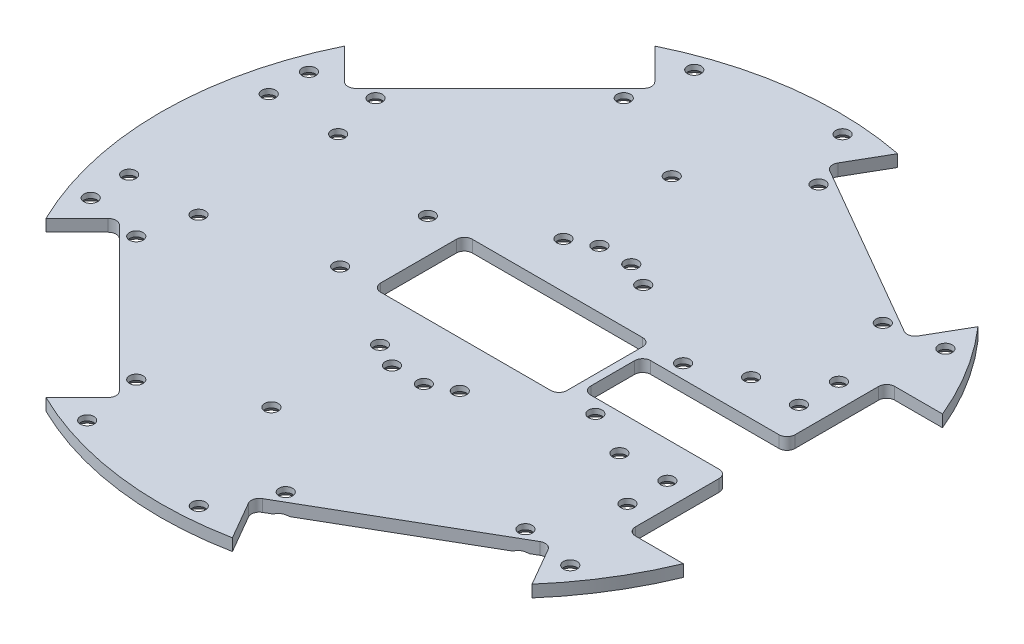
from build123d import *

# Parameters (mm, degrees)
ESBO_O1_R                            = 1.7
ESBO_O1_R_2                          = 1.5
BASE_DEPTH                           = 3
ESBO_O21_R                           = 1.5
BOCA_CHUTE_DEPTH                     = 20
ESBO_O32_W                           = 15
ESBO_O32_H                           = 3
CORTE_EXTRUS_O2_DEPTH                = 36.19
ESBO_O33_W                           = 46.7
ESBO_O33_H                           = 23
CORTE_EXTRUS_O3_DEPTH                = 121.245582039
ESCAREADO_PARA_SFHCS_M31_AT_2_COUNT  = 2
ESCAREADO_PARA_SFHCS_M31_AT_2_PITCH  = 21.433109141
ESCAREADO_PARA_SFHCS_M31_AT_3_COUNT  = 2
ESCAREADO_PARA_SFHCS_M31_AT_3_PITCH  = 31.142167091
ESCAREADO_PARA_SFHCS_M31_AT_4_COUNT  = 2
ESCAREADO_PARA_SFHCS_M31_AT_4_PITCH  = 13.637440316
ESCAREADO_PARA_SFHCS_M31_AT_5_COUNT  = 2
ESCAREADO_PARA_SFHCS_M31_AT_5_PITCH  = 35.526804411
ESCAREADO_PARA_SFHCS_M31_AT_6_COUNT  = 2
ESCAREADO_PARA_SFHCS_M31_AT_6_PITCH  = 46.701207559
ESCAREADO_PARA_SFHCS_M31_AT_7_COUNT  = 2
ESCAREADO_PARA_SFHCS_M31_AT_7_PITCH  = 55.221424698
ESCAREADO_PARA_SFHCS_M31_AT_8_COUNT  = 2
ESCAREADO_PARA_SFHCS_M31_AT_8_PITCH  = 68.331301379
ESCAREADO_PARA_SFHCS_M31_AT_9_COUNT  = 2
ESCAREADO_PARA_SFHCS_M31_AT_9_PITCH  = 71.833928112
ESCAREADO_PARA_SFHCS_M31_AT_10_COUNT = 2
ESCAREADO_PARA_SFHCS_M31_AT_10_PITCH = 69.001855552
ESCAREADO_PARA_SFHCS_M31_AT_11_COUNT = 2
ESCAREADO_PARA_SFHCS_M31_AT_11_PITCH = 61.430565004
ESCAREADO_PARA_SFHCS_M31_AT_12_COUNT = 2
ESCAREADO_PARA_SFHCS_M31_AT_12_PITCH = 57.028018756
ESCAREADO_PARA_SFHCS_M31_AT_13_COUNT = 2
ESCAREADO_PARA_SFHCS_M31_AT_13_PITCH = 75.637618321
ESCAREADO_PARA_SFHCS_M31_AT_14_COUNT = 2
ESCAREADO_PARA_SFHCS_M31_AT_14_PITCH = 96.525270503
ESCAREADO_PARA_SFHCS_M31_AT_15_COUNT = 2
ESCAREADO_PARA_SFHCS_M31_AT_15_PITCH = 95.765279894
ESCAREADO_PARA_SFHCS_M31_AT_16_COUNT = 2
ESCAREADO_PARA_SFHCS_M31_AT_16_PITCH = 100.405860436
ESCAREADO_PARA_SFHCS_M31_AT_17_COUNT = 2
ESCAREADO_PARA_SFHCS_M31_AT_17_PITCH = 126.981552798
ESCAREADO_PARA_SFHCS_M31_AT_18_COUNT = 2
ESCAREADO_PARA_SFHCS_M31_AT_18_PITCH = 126.222537613
ESCAREADO_PARA_SFHCS_M31_AT_19_COUNT = 2
ESCAREADO_PARA_SFHCS_M31_AT_19_PITCH = 143.196261927
ESCAREADO_PARA_SFHCS_M31_AT_20_COUNT = 2
ESCAREADO_PARA_SFHCS_M31_AT_20_PITCH = 141.271614857
ESCAREADO_PARA_SFHCS_M31_AT_21_COUNT = 2
ESCAREADO_PARA_SFHCS_M31_AT_21_PITCH = 65.192076785
ESCAREADO_PARA_SFHCS_M31_AT_22_COUNT = 2
ESCAREADO_PARA_SFHCS_M31_AT_22_PITCH = 66.073141016
ESCAREADO_PARA_SFHCS_M31_AT_23_COUNT = 2
ESCAREADO_PARA_SFHCS_M31_AT_23_PITCH = 63.822728735
ESCAREADO_PARA_SFHCS_M31_AT_24_COUNT = 2
ESCAREADO_PARA_SFHCS_M31_AT_24_PITCH = 73.782092047
ESCAREADO_PARA_SFHCS_M31_AT_25_COUNT = 2
ESCAREADO_PARA_SFHCS_M31_AT_25_PITCH = 94.045640367
ESCAREADO_PARA_SFHCS_M31_AT_26_COUNT = 2
ESCAREADO_PARA_SFHCS_M31_AT_26_PITCH = 92.800098367
ESCAREADO_PARA_SFHCS_M31_AT_27_COUNT = 2
ESCAREADO_PARA_SFHCS_M31_AT_27_PITCH = 124.953160826
ESCAREADO_PARA_SFHCS_M31_AT_28_COUNT = 2
ESCAREADO_PARA_SFHCS_M31_AT_28_PITCH = 140.887171602
ESCAREADO_PARA_SFHCS_M31_AT_29_COUNT = 2
ESCAREADO_PARA_SFHCS_M31_AT_29_PITCH = 120.82932396
ESCAREADO_PARA_SFHCS_M31_AT_30_COUNT = 2
ESCAREADO_PARA_SFHCS_M31_AT_30_PITCH = 87.05339959
ESCAREADO_PARA_SFHCS_M31_AT_31_COUNT = 2
ESCAREADO_PARA_SFHCS_M31_AT_31_PITCH = 93.08108087
ESCAREADO_PARA_SFHCS_M31_AT_32_COUNT = 2
ESCAREADO_PARA_SFHCS_M31_AT_32_PITCH = 98.24270644
ESCAREADO_PARA_SFHCS_M31_AT_33_COUNT = 2
ESCAREADO_PARA_SFHCS_M31_AT_33_PITCH = 100.235466588
ESCAREADO_PARA_SFHCS_M31_AT_34_COUNT = 2
ESCAREADO_PARA_SFHCS_M31_AT_34_PITCH = 143.756871864
ESCAREADO_PARA_SFHCS_M31_AT_35_COUNT = 2
ESCAREADO_PARA_SFHCS_M31_AT_35_PITCH = 153.728274182
ESCAREADO_PARA_SFHCS_M31_AT_36_COUNT = 2
ESCAREADO_PARA_SFHCS_M31_AT_36_PITCH = 110.228584759
ESCAREADO_PARA_SFHCS_M31_AT_37_COUNT = 2
ESCAREADO_PARA_SFHCS_M31_AT_37_PITCH = 138.649653495
ESCAREADO_PARA_SFHCS_M31_AT_38_COUNT = 2
ESCAREADO_PARA_SFHCS_M31_AT_38_PITCH = 154.262007126
ESCAREADO_PARA_SFHCS_M31_AT_39_COUNT = 2
ESCAREADO_PARA_SFHCS_M31_AT_39_PITCH = 158.442890999
ESCAREADO_PARA_SFHCS_M31_AT_40_COUNT = 2
ESCAREADO_PARA_SFHCS_M31_AT_40_PITCH = 147.537577729
FILETE1_R                            = 2


with BuildPart() as part:
    # Esboço1 → Base (new body)
    with BuildSketch(Plane(origin=(0, 0, 0), x_dir=(1, 0, 0), z_dir=(0, 1, 0))):
        with BuildLine():
            Line((-67.124614158, -28.233741192), (-28.233741192, -67.124614158))
            Line((-28.233741192, -67.124614158), (-37.426129348, -76.317002313))
            ThreePointArc((-37.426129348, -76.317002313), (-11.094726339, -84.272813217), (16.398571251, -83.403158579))
            Line((16.398571251, -83.403158579), (9.898571251, -72.14482833))
            Line((9.898571251, -72.14482833), (57.529968459, -44.64482833))
            Line((57.529968459, -44.64482833), (64.029968459, -55.903158579))
            ThreePointArc((64.029968459, -55.903158579), (85, 0), (64.029968459, 55.903158579))
            Line((64.029968459, 55.903158579), (57.529968459, 44.64482833))
            Line((57.529968459, 44.64482833), (9.898571251, 72.14482833))
            Line((9.898571251, 72.14482833), (16.398571251, 83.403158579))
            ThreePointArc((16.398571251, 83.403158579), (-11.094726339, 84.272813217), (-37.426129348, 76.317002313))
            Line((-37.426129348, 76.317002313), (-28.233741192, 67.124614158))
            Line((-28.233741192, 67.124614158), (-67.124614158, 28.233741192))
            Line((-67.124614158, 28.233741192), (-76.317002313, 37.426129348))
            ThreePointArc((-76.317002313, 37.426129348), (-85, 0), (-76.317002313, -37.426129348))
            Line((-76.317002313, -37.426129348), (-67.124614158, -28.233741192))
        make_face()
        with Locations(Location((-61.114206518, -30.001508145, 0), (0, 0, 270))):
            Circle(ESBO_O1_R, mode=Mode.SUBTRACT)
        with Locations(Location((-30.001508145, -61.114206518, 0), (0, 0, 90))):
            Circle(ESBO_O1_R, mode=Mode.SUBTRACT)
        with Locations(Location((13.161710972, -66.796752118, 0), (0, 0, 270))):
            Circle(ESBO_O1_R, mode=Mode.SUBTRACT)
        with Locations(Location((51.266828739, -44.796752118, 0), (0, 0, 90))):
            Circle(ESBO_O1_R, mode=Mode.SUBTRACT)
        with Locations(Location((-61.114206518, 30.001508145, 0), (0, 0, 90))):
            Circle(ESBO_O1_R, mode=Mode.SUBTRACT)
        with Locations(Location((-30.001508145, 61.114206518, 0), (0, 0, 270))):
            Circle(ESBO_O1_R, mode=Mode.SUBTRACT)
        with Locations(Location((13.161710972, 66.796752118, 0), (0, 0, 90))):
            Circle(ESBO_O1_R, mode=Mode.SUBTRACT)
        with Locations(Location((51.266828739, 44.796752118, 0), (0, 0, 270))):
            Circle(ESBO_O1_R, mode=Mode.SUBTRACT)
        with Locations(Location((-75.398491, 17.5, 0), (0, 0, 270))):
            Circle(ESBO_O1_R_2, mode=Mode.SUBTRACT)
        with Locations(Location((-58, 17.5, 0), (0, 0, 270))):
            Circle(ESBO_O1_R_2, mode=Mode.SUBTRACT)
        with Locations(Location((-58, -17.5, 0), (0, 0, 90))):
            Circle(ESBO_O1_R_2, mode=Mode.SUBTRACT)
        with Locations(Location((-75.398491, -17.5, 0), (0, 0, 90))):
            Circle(ESBO_O1_R_2, mode=Mode.SUBTRACT)
        with Locations(Location((-27.317649341, 76.108017243, 0), (0, 0, 270))):
            Circle(ESBO_O1_R_2, mode=Mode.SUBTRACT)
        with Locations(Location((-75.175409663, 27.361611466, 0), (0, 0, 270))):
            Circle(ESBO_O1_R_2, mode=Mode.SUBTRACT)
        with Locations(Location((64.72135955, 47.022820183, 0), (0, 0, 270))):
            Circle(ESBO_O1_R_2, mode=Mode.SUBTRACT)
        with Locations(Location((64.72135955, -47.022820183, 0), (0, 0, 90))):
            Circle(ESBO_O1_R_2, mode=Mode.SUBTRACT)
        with Locations(Location((-75.175409663, -27.361611466, 0), (0, 0, 90))):
            Circle(ESBO_O1_R_2, mode=Mode.SUBTRACT)
        with Locations(Location((7, -26, 0), (0, 0, 270))):
            Circle(ESBO_O1_R_2, mode=Mode.SUBTRACT)
        with Locations(Location((13, -23, 0), (0, 0, 270))):
            Circle(ESBO_O1_R_2, mode=Mode.SUBTRACT)
        with Locations(Location((35, -11, 0), (0, 0, 270))):
            Circle(ESBO_O1_R_2, mode=Mode.SUBTRACT)
        with Locations(Location((5.268571782, 80.705646294, 0), (0, 0, 270))):
            Circle(ESBO_O1_R_2, mode=Mode.SUBTRACT)
        with Locations(Location((-7.042875224, 50.186336462, 0), (0, 0, 270))):
            Circle(ESBO_O1_R_2, mode=Mode.SUBTRACT)
        with Locations(Location((-27.317649341, -76.108017243, 0), (0, 0, 90))):
            Circle(ESBO_O1_R_2, mode=Mode.SUBTRACT)
        with Locations(Location((5.268571782, -80.705646294, 0), (0, 0, 90))):
            Circle(ESBO_O1_R_2, mode=Mode.SUBTRACT)
        with Locations(Location((-7.042875224, -50.186336462, 0), (0, 0, 90))):
            Circle(ESBO_O1_R_2, mode=Mode.SUBTRACT)
        with Locations(Location((-29, -11, 0), (0, 0, 90))):
            Circle(ESBO_O1_R_2, mode=Mode.SUBTRACT)
        with Locations(Location((-7, -23, 0), (0, 0, 90))):
            Circle(ESBO_O1_R_2, mode=Mode.SUBTRACT)
        with Locations(Location((-1, -26, 0), (0, 0, 90))):
            Circle(ESBO_O1_R_2, mode=Mode.SUBTRACT)
        with Locations(Location((35, 11, 0), (0, 0, 90))):
            Circle(ESBO_O1_R_2, mode=Mode.SUBTRACT)
        with Locations(Location((13, 23, 0), (0, 0, 90))):
            Circle(ESBO_O1_R_2, mode=Mode.SUBTRACT)
        with Locations(Location((7, 26, 0), (0, 0, 90))):
            Circle(ESBO_O1_R_2, mode=Mode.SUBTRACT)
        with Locations(Location((-1, 26, 0), (0, 0, 270))):
            Circle(ESBO_O1_R_2, mode=Mode.SUBTRACT)
        with Locations(Location((-7, 23, 0), (0, 0, 270))):
            Circle(ESBO_O1_R_2, mode=Mode.SUBTRACT)
        with Locations(Location((-29, 11, 0), (0, 0, 270))):
            Circle(ESBO_O1_R_2, mode=Mode.SUBTRACT)
    extrude(amount=BASE_DEPTH)

    # Esboço21 → Boca Chute (cut)
    with BuildSketch(Plane.XZ):
        with Locations(Location((58.541390362, 26.5, 0), (0, 0, 270))):
            Circle(ESBO_O21_R)
        with Locations(Location((58.541390362, 16.5, 0), (0, 0, 270))):
            Circle(ESBO_O21_R)
        with Locations(Location((46.541390362, 16.5, 0), (0, 0, 270))):
            Circle(ESBO_O21_R)
        with Locations(Location((46.541390362, -16.5, 0), (0, 0, 90))):
            Circle(ESBO_O21_R)
        with Locations(Location((58.541390362, -16.5, 0), (0, 0, 90))):
            Circle(ESBO_O21_R)
        with Locations(Location((58.541390362, -26.5, 0), (0, 0, 90))):
            Circle(ESBO_O21_R)
        with BuildLine():
            Line((64.541390362, -32.5), (78.541390362, -32.5))
            ThreePointArc((78.541390362, -32.5), (85, 0), (78.541390362, 32.5))
            Line((78.541390362, 32.5), (64.541390362, 32.5))
            Line((64.541390362, 32.5), (64.541390362, -32.5))
        make_face()
    extrude(amount=-BOCA_CHUTE_DEPTH, mode=Mode.SUBTRACT)

    # Esboço32 → Corte-extrusão2 (cut)
    with BuildSketch(Plane(origin=(64.541390362, 0, 0), x_dir=(0, 0, -1), z_dir=(1, 0, 0))):
        with Locations((0, 1.5)):
            Rectangle(ESBO_O32_W, ESBO_O32_H)
    extrude(amount=-CORTE_EXTRUS_O2_DEPTH, mode=Mode.SUBTRACT)

    # Esboço33 → Corte-extrusão3 (cut, through all)
    with BuildSketch(Plane(origin=(0, 3, 0), x_dir=(1, 0, 0), z_dir=(0, 1, 0))):
        with Locations((3.001390362, 0)):
            Rectangle(ESBO_O33_W, ESBO_O33_H)
    extrude(amount=-CORTE_EXTRUS_O3_DEPTH, mode=Mode.SUBTRACT)

    # Esboço35 → Escareado para SFHCS M31 (revolve, cut)
    with BuildSketch(Plane(origin=(64.72135955, 0, -47.022820183), x_dir=(0, 0, -1), z_dir=(1, 0, 0))):
        Polygon((0, 0), (0, 3), (1.7, 3), (1.7, 1.66), (3.36, 0), align=None)
    escareado_para_sfhcs_m31 = revolve(axis=Axis((64.72135955, -6.35, -47.022820183), (0, 1, 0)), mode=Mode.SUBTRACT)

    # Escareado para SFHCS M31 at 2: Escareado para SFHCS M31 ×2
    with Locations(*[Vector(-0.28833750378228473, 0, 0.9575288423398018) * (i * ESCAREADO_PARA_SFHCS_M31_AT_2_PITCH) for i in range(1, ESCAREADO_PARA_SFHCS_M31_AT_2_COUNT)]):
        add(escareado_para_sfhcs_m31, mode=Mode.SUBTRACT)

    # Escareado para SFHCS M31 at 3: Escareado para SFHCS M31 ×2
    with Locations(*[Vector(-0.19844377463999807, 0, 0.9801122733170061) * (i * ESCAREADO_PARA_SFHCS_M31_AT_3_PITCH) for i in range(1, ESCAREADO_PARA_SFHCS_M31_AT_3_COUNT)]):
        add(escareado_para_sfhcs_m31, mode=Mode.SUBTRACT)

    # Escareado para SFHCS M31 at 4: Escareado para SFHCS M31 ×2
    with Locations(*[Vector(-0.9865876952829133, 0, 0.16323210320384116) * (i * ESCAREADO_PARA_SFHCS_M31_AT_4_PITCH) for i in range(1, ESCAREADO_PARA_SFHCS_M31_AT_4_COUNT)]):
        add(escareado_para_sfhcs_m31, mode=Mode.SUBTRACT)

    # Escareado para SFHCS M31 at 5: Escareado para SFHCS M31 ×2
    with Locations(*[Vector(-0.5117254278739988, 0, 0.8591490478765444) * (i * ESCAREADO_PARA_SFHCS_M31_AT_5_PITCH) for i in range(1, ESCAREADO_PARA_SFHCS_M31_AT_5_COUNT)]):
        add(escareado_para_sfhcs_m31, mode=Mode.SUBTRACT)

    # Escareado para SFHCS M31 at 6: Escareado para SFHCS M31 ×2
    with Locations(*[Vector(-0.6364152257191596, 0, 0.7713466538935857) * (i * ESCAREADO_PARA_SFHCS_M31_AT_6_PITCH) for i in range(1, ESCAREADO_PARA_SFHCS_M31_AT_6_COUNT)]):
        add(escareado_para_sfhcs_m31, mode=Mode.SUBTRACT)

    # Escareado para SFHCS M31 at 7: Escareado para SFHCS M31 ×2
    with Locations(*[Vector(-0.9336892132027962, 0, -0.35808442181801703) * (i * ESCAREADO_PARA_SFHCS_M31_AT_7_PITCH) for i in range(1, ESCAREADO_PARA_SFHCS_M31_AT_7_COUNT)]):
        add(escareado_para_sfhcs_m31, mode=Mode.SUBTRACT)

    # Escareado para SFHCS M31 at 8: Escareado para SFHCS M31 ×2
    with Locations(*[Vector(-0.8700666688294272, 0, -0.49293406434538883) * (i * ESCAREADO_PARA_SFHCS_M31_AT_8_PITCH) for i in range(1, ESCAREADO_PARA_SFHCS_M31_AT_8_COUNT)]):
        add(escareado_para_sfhcs_m31, mode=Mode.SUBTRACT)

    # Escareado para SFHCS M31 at 9: Escareado para SFHCS M31 ×2
    with Locations(*[Vector(-0.9990297991568213, 0, -0.04403930513395204) * (i * ESCAREADO_PARA_SFHCS_M31_AT_9_PITCH) for i in range(1, ESCAREADO_PARA_SFHCS_M31_AT_9_COUNT)]):
        add(escareado_para_sfhcs_m31, mode=Mode.SUBTRACT)

    # Escareado para SFHCS M31 at 10: Escareado para SFHCS M31 ×2
    with Locations(*[Vector(-0.9524578581927121, 0, 0.30467036017136856) * (i * ESCAREADO_PARA_SFHCS_M31_AT_10_PITCH) for i in range(1, ESCAREADO_PARA_SFHCS_M31_AT_10_COUNT)]):
        add(escareado_para_sfhcs_m31, mode=Mode.SUBTRACT)

    # Escareado para SFHCS M31 at 11: Escareado para SFHCS M31 ×2
    with Locations(*[Vector(-0.9396195451862507, 0, 0.3422208501888561) * (i * ESCAREADO_PARA_SFHCS_M31_AT_11_PITCH) for i in range(1, ESCAREADO_PARA_SFHCS_M31_AT_11_COUNT)]):
        add(escareado_para_sfhcs_m31, mode=Mode.SUBTRACT)

    # Escareado para SFHCS M31 at 12: Escareado para SFHCS M31 ×2
    with Locations(*[Vector(-0.9069464568120339, 0, 0.4212459192396973) * (i * ESCAREADO_PARA_SFHCS_M31_AT_12_PITCH) for i in range(1, ESCAREADO_PARA_SFHCS_M31_AT_12_COUNT)]):
        add(escareado_para_sfhcs_m31, mode=Mode.SUBTRACT)

    # Escareado para SFHCS M31 at 13: Escareado para SFHCS M31 ×2
    with Locations(*[Vector(-0.9482233991778616, 0, 0.3176041329258513) * (i * ESCAREADO_PARA_SFHCS_M31_AT_13_PITCH) for i in range(1, ESCAREADO_PARA_SFHCS_M31_AT_13_COUNT)]):
        add(escareado_para_sfhcs_m31, mode=Mode.SUBTRACT)

    # Escareado para SFHCS M31 at 14: Escareado para SFHCS M31 ×2
    with Locations(*[Vector(-0.9535224134733126, 0, -0.30132209843293795) * (i * ESCAREADO_PARA_SFHCS_M31_AT_14_PITCH) for i in range(1, ESCAREADO_PARA_SFHCS_M31_AT_14_COUNT)]):
        add(escareado_para_sfhcs_m31, mode=Mode.SUBTRACT)

    # Escareado para SFHCS M31 at 15: Escareado para SFHCS M31 ×2
    with Locations(*[Vector(-0.9891149255745378, 0, -0.1471450441084455) * (i * ESCAREADO_PARA_SFHCS_M31_AT_15_PITCH) for i in range(1, ESCAREADO_PARA_SFHCS_M31_AT_15_COUNT)]):
        add(escareado_para_sfhcs_m31, mode=Mode.SUBTRACT)

    # Escareado para SFHCS M31 at 16: Escareado para SFHCS M31 ×2
    with Locations(*[Vector(-0.9334251919475125, 0, 0.3587720878743907) * (i * ESCAREADO_PARA_SFHCS_M31_AT_16_PITCH) for i in range(1, ESCAREADO_PARA_SFHCS_M31_AT_16_COUNT)]):
        add(escareado_para_sfhcs_m31, mode=Mode.SUBTRACT)

    # Escareado para SFHCS M31 at 17: Escareado para SFHCS M31 ×2
    with Locations(*[Vector(-0.9909751715474716, 0, 0.13404554963317217) * (i * ESCAREADO_PARA_SFHCS_M31_AT_17_PITCH) for i in range(1, ESCAREADO_PARA_SFHCS_M31_AT_17_COUNT)]):
        add(escareado_para_sfhcs_m31, mode=Mode.SUBTRACT)

    # Escareado para SFHCS M31 at 18: Escareado para SFHCS M31 ×2
    with Locations(*[Vector(-0.972261862826646, 0, 0.2338949980073545) * (i * ESCAREADO_PARA_SFHCS_M31_AT_18_PITCH) for i in range(1, ESCAREADO_PARA_SFHCS_M31_AT_18_COUNT)]):
        add(escareado_para_sfhcs_m31, mode=Mode.SUBTRACT)

    # Escareado para SFHCS M31 at 19: Escareado para SFHCS M31 ×2
    with Locations(*[Vector(-0.9785161195190776, 0, 0.2061703272571644) * (i * ESCAREADO_PARA_SFHCS_M31_AT_19_PITCH) for i in range(1, ESCAREADO_PARA_SFHCS_M31_AT_19_COUNT)]):
        add(escareado_para_sfhcs_m31, mode=Mode.SUBTRACT)

    # Escareado para SFHCS M31 at 20: Escareado para SFHCS M31 ×2
    with Locations(*[Vector(-0.9902680687415707, 0, 0.13917310096006244) * (i * ESCAREADO_PARA_SFHCS_M31_AT_20_PITCH) for i in range(1, ESCAREADO_PARA_SFHCS_M31_AT_20_COUNT)]):
        add(escareado_para_sfhcs_m31, mode=Mode.SUBTRACT)

    # Escareado para SFHCS M31 at 21: Escareado para SFHCS M31 ×2
    with Locations(*[Vector(-0.45590447514101445, 0, 0.8900287127651536) * (i * ESCAREADO_PARA_SFHCS_M31_AT_21_PITCH) for i in range(1, ESCAREADO_PARA_SFHCS_M31_AT_21_COUNT)]):
        add(escareado_para_sfhcs_m31, mode=Mode.SUBTRACT)

    # Escareado para SFHCS M31 at 22: Escareado para SFHCS M31 ×2
    with Locations(*[Vector(-0.2751491590743778, 0, 0.9614015499574894) * (i * ESCAREADO_PARA_SFHCS_M31_AT_22_PITCH) for i in range(1, ESCAREADO_PARA_SFHCS_M31_AT_22_COUNT)]):
        add(escareado_para_sfhcs_m31, mode=Mode.SUBTRACT)

    # Escareado para SFHCS M31 at 23: Escareado para SFHCS M31 ×2
    with Locations(*[Vector(-0.09683022506925976, 0, 0.9953009130474244) * (i * ESCAREADO_PARA_SFHCS_M31_AT_23_PITCH) for i in range(1, ESCAREADO_PARA_SFHCS_M31_AT_23_COUNT)]):
        add(escareado_para_sfhcs_m31, mode=Mode.SUBTRACT)

    # Escareado para SFHCS M31 at 24: Escareado para SFHCS M31 ×2
    with Locations(*[Vector(-0.08375974462752434, 0, 0.99648597841612) * (i * ESCAREADO_PARA_SFHCS_M31_AT_24_PITCH) for i in range(1, ESCAREADO_PARA_SFHCS_M31_AT_24_COUNT)]):
        add(escareado_para_sfhcs_m31, mode=Mode.SUBTRACT)

    # Escareado para SFHCS M31 at 25: Escareado para SFHCS M31 ×2
    with Locations(*[(0, 0, i * ESCAREADO_PARA_SFHCS_M31_AT_25_PITCH) for i in range(1, ESCAREADO_PARA_SFHCS_M31_AT_25_COUNT)]):
        add(escareado_para_sfhcs_m31, mode=Mode.SUBTRACT)

    # Escareado para SFHCS M31 at 26: Escareado para SFHCS M31 ×2
    with Locations(*[Vector(-0.14498401454384457, 0, 0.9894339975595898) * (i * ESCAREADO_PARA_SFHCS_M31_AT_26_PITCH) for i in range(1, ESCAREADO_PARA_SFHCS_M31_AT_26_COUNT)]):
        add(escareado_para_sfhcs_m31, mode=Mode.SUBTRACT)

    # Escareado para SFHCS M31 at 27: Escareado para SFHCS M31 ×2
    with Locations(*[Vector(-0.4126318072873952, 0, 0.9108979040566171) * (i * ESCAREADO_PARA_SFHCS_M31_AT_27_PITCH) for i in range(1, ESCAREADO_PARA_SFHCS_M31_AT_27_COUNT)]):
        add(escareado_para_sfhcs_m31, mode=Mode.SUBTRACT)

    # Escareado para SFHCS M31 at 28: Escareado para SFHCS M31 ×2
    with Locations(*[Vector(-0.4219886529886094, 0, 0.9066011122587811) * (i * ESCAREADO_PARA_SFHCS_M31_AT_28_PITCH) for i in range(1, ESCAREADO_PARA_SFHCS_M31_AT_28_COUNT)]):
        add(escareado_para_sfhcs_m31, mode=Mode.SUBTRACT)

    # Escareado para SFHCS M31 at 29: Escareado para SFHCS M31 ×2
    with Locations(*[Vector(-0.5939306157021539, 0, 0.8045162669155053) * (i * ESCAREADO_PARA_SFHCS_M31_AT_29_PITCH) for i in range(1, ESCAREADO_PARA_SFHCS_M31_AT_29_COUNT)]):
        add(escareado_para_sfhcs_m31, mode=Mode.SUBTRACT)

    # Escareado para SFHCS M31 at 30: Escareado para SFHCS M31 ×2
    with Locations(*[Vector(-0.5941337132579173, 0, 0.8043662914185048) * (i * ESCAREADO_PARA_SFHCS_M31_AT_30_PITCH) for i in range(1, ESCAREADO_PARA_SFHCS_M31_AT_30_COUNT)]):
        add(escareado_para_sfhcs_m31, mode=Mode.SUBTRACT)

    # Escareado para SFHCS M31 at 31: Escareado para SFHCS M31 ×2
    with Locations(*[Vector(-0.6201191371092247, 0, 0.7845076518370683) * (i * ESCAREADO_PARA_SFHCS_M31_AT_31_PITCH) for i in range(1, ESCAREADO_PARA_SFHCS_M31_AT_31_COUNT)]):
        add(escareado_para_sfhcs_m31, mode=Mode.SUBTRACT)

    # Escareado para SFHCS M31 at 32: Escareado para SFHCS M31 ×2
    with Locations(*[Vector(-0.6689693508209702, 0, 0.7432899889425187) * (i * ESCAREADO_PARA_SFHCS_M31_AT_32_PITCH) for i in range(1, ESCAREADO_PARA_SFHCS_M31_AT_32_COUNT)]):
        add(escareado_para_sfhcs_m31, mode=Mode.SUBTRACT)

    # Escareado para SFHCS M31 at 33: Escareado para SFHCS M31 ×2
    with Locations(*[Vector(-0.7155287643316391, 0, 0.6985832716391351) * (i * ESCAREADO_PARA_SFHCS_M31_AT_33_PITCH) for i in range(1, ESCAREADO_PARA_SFHCS_M31_AT_33_COUNT)]):
        add(escareado_para_sfhcs_m31, mode=Mode.SUBTRACT)

    # Escareado para SFHCS M31 at 34: Escareado para SFHCS M31 ×2
    with Locations(*[Vector(-0.6589101895934748, 0, 0.7522216176432921) * (i * ESCAREADO_PARA_SFHCS_M31_AT_34_PITCH) for i in range(1, ESCAREADO_PARA_SFHCS_M31_AT_34_COUNT)]):
        add(escareado_para_sfhcs_m31, mode=Mode.SUBTRACT)

    # Escareado para SFHCS M31 at 35: Escareado para SFHCS M31 ×2
    with Locations(*[Vector(-0.5987123018253212, 0, 0.8009641562785599) * (i * ESCAREADO_PARA_SFHCS_M31_AT_35_PITCH) for i in range(1, ESCAREADO_PARA_SFHCS_M31_AT_35_COUNT)]):
        add(escareado_para_sfhcs_m31, mode=Mode.SUBTRACT)

    # Escareado para SFHCS M31 at 36: Escareado para SFHCS M31 ×2
    with Locations(*[Vector(-0.8502455125868664, 0, 0.5263863299192875) * (i * ESCAREADO_PARA_SFHCS_M31_AT_36_PITCH) for i in range(1, ESCAREADO_PARA_SFHCS_M31_AT_36_COUNT)]):
        add(escareado_para_sfhcs_m31, mode=Mode.SUBTRACT)

    # Escareado para SFHCS M31 at 37: Escareado para SFHCS M31 ×2
    with Locations(*[Vector(-0.8851184006358117, 0, 0.4653658956733967) * (i * ESCAREADO_PARA_SFHCS_M31_AT_37_PITCH) for i in range(1, ESCAREADO_PARA_SFHCS_M31_AT_37_COUNT)]):
        add(escareado_para_sfhcs_m31, mode=Mode.SUBTRACT)

    # Escareado para SFHCS M31 at 38: Escareado para SFHCS M31 ×2
    with Locations(*[Vector(-0.9083237873046625, 0, 0.4182677341327137) * (i * ESCAREADO_PARA_SFHCS_M31_AT_38_PITCH) for i in range(1, ESCAREADO_PARA_SFHCS_M31_AT_38_COUNT)]):
        add(escareado_para_sfhcs_m31, mode=Mode.SUBTRACT)

    # Escareado para SFHCS M31 at 39: Escareado para SFHCS M31 ×2
    with Locations(*[Vector(-0.8829475928589281, 0, 0.4694715627858887) * (i * ESCAREADO_PARA_SFHCS_M31_AT_39_PITCH) for i in range(1, ESCAREADO_PARA_SFHCS_M31_AT_39_COUNT)]):
        add(escareado_para_sfhcs_m31, mode=Mode.SUBTRACT)

    # Escareado para SFHCS M31 at 40: Escareado para SFHCS M31 ×2
    with Locations(*[Vector(-0.8529051920521731, 0, 0.5220658324104783) * (i * ESCAREADO_PARA_SFHCS_M31_AT_40_PITCH) for i in range(1, ESCAREADO_PARA_SFHCS_M31_AT_40_COUNT)]):
        add(escareado_para_sfhcs_m31, mode=Mode.SUBTRACT)

    # Filete1
    filete1_edges = [part.edges().sort_by_distance(p)[0] for p in [
        (64.541390362, 1.5, -32.5),
        (64.541390362, 1.5, 32.5),
        (28.351390362, 1.5, -7.5),
        (28.351390362, 1.5, 7.5),
        (64.541390362, 1.5, -7.5),
        (64.541390362, 1.5, 7.5),
        (26.351390362, 1.5, -11.5),
        (26.351390362, 1.5, 11.5),
        (-20.348609638, 1.5, 11.5),
        (-20.348609638, 1.5, -11.5),
        (9.898571251, 1.5, -72.14482833),
        (57.529968459, 1.5, -44.64482833),
        (57.529968459, 1.5, 44.64482833),
        (9.898571251, 1.5, 72.14482833),
        (-28.233741192, 1.5, 67.124614158),
        (-67.124614158, 1.5, 28.233741192),
        (-67.124614158, 1.5, -28.233741192),
        (-28.233741192, 1.5, -67.124614158),
    ]]
    fillet(filete1_edges, radius=FILETE1_R)


solid = part.part
